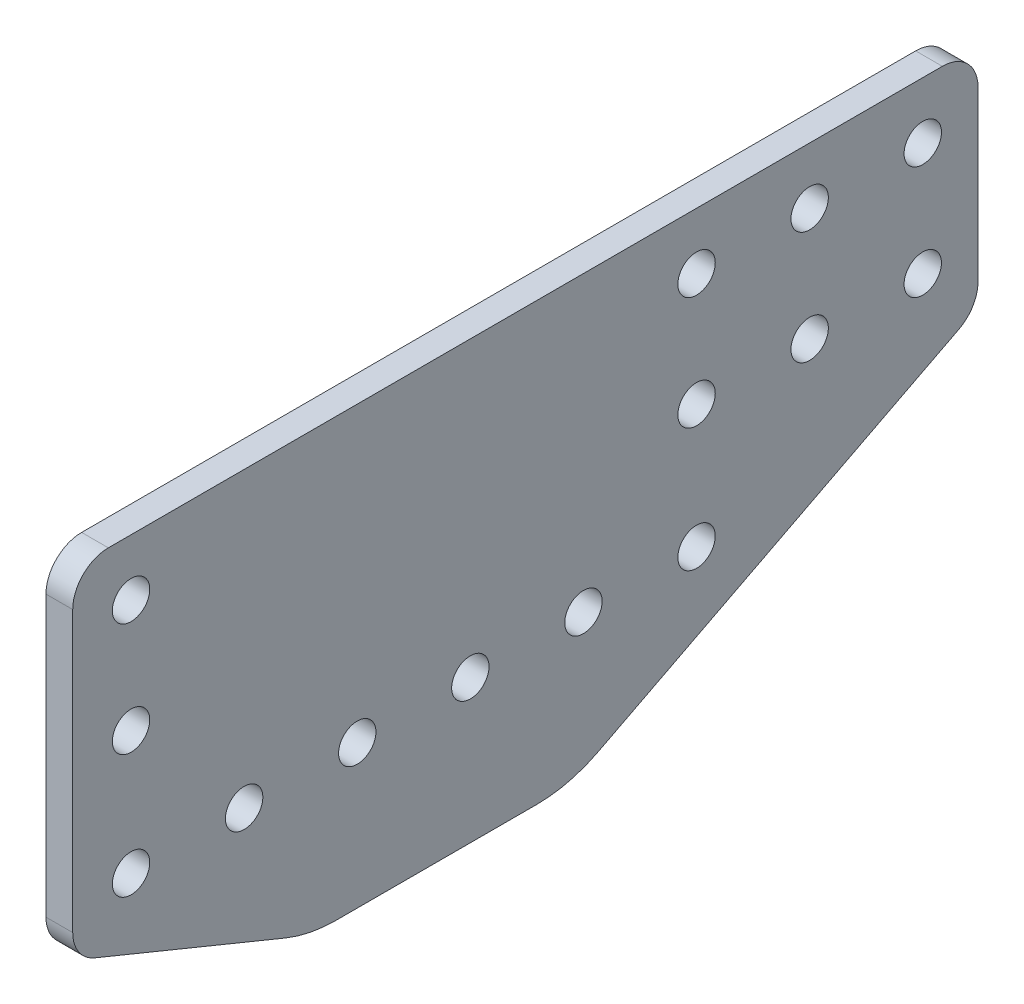
from build123d import *

# Parameters (mm, degrees)
SKETCH_1_R      = 2.1
EXTRUDE_1_DEPTH = 3


with BuildPart() as part:
    # 草图1 → 凸台-拉伸1 (new body)
    with BuildSketch(Plane(origin=(0, 0, 0), x_dir=(0, 0, -1), z_dir=(1, 0, 0))):
        with BuildLine():
            Line((59.529555332, 44.185221984), (59.529555332, 25.226213997))
            ThreePointArc((59.529555332, 25.226213997), (58.943993255, 23.142560073), (57.358748495, 21.668960509))
            Line((57.358748495, 21.668960509), (16.843911029, 0.835622672))
            ThreePointArc((16.843911029, 0.835622672), (13.51321063, -0.403694355), (9.984436669, -0.82467675))
            Line((9.984436669, -0.82467675), (-12.543438126, -0.82467675))
            ThreePointArc((-12.543438126, -0.82467675), (-15.441612868, -0.542033278), (-18.230567587, 0.295245495))
            Line((-18.230567587, 0.295245495), (-39.640671861, 9.067677244))
            ThreePointArc((-39.640671861, 9.067677244), (-41.445720436, 10.540385022), (-42.124104005, 12.769031312))
            Line((-42.124104005, 12.769031312), (-42.124104005, 44.185221984))
            ThreePointArc((-42.124104005, 44.185221984), (-40.95253113, 47.013649109), (-38.124104005, 48.185221984))
            Line((-38.124104005, 48.185221984), (-2.92315645, 48.185221984))
            Line((-2.92315645, 48.185221984), (55.529555332, 48.185221984))
            ThreePointArc((55.529555332, 48.185221984), (58.357982457, 47.013649109), (59.529555332, 44.185221984))
        make_face()
        with Locations((40.626001942, 41.835221984)):
            Circle(SKETCH_1_R, mode=Mode.SUBTRACT)
        with Locations((-35.573998058, 15.266821984)):
            Circle(SKETCH_1_R, mode=Mode.SUBTRACT)
        with Locations((-22.873998058, 15.266821984)):
            Circle(SKETCH_1_R, mode=Mode.SUBTRACT)
        with Locations((-10.173998058, 15.266821984)):
            Circle(SKETCH_1_R, mode=Mode.SUBTRACT)
        with Locations((2.526001942, 15.266821984)):
            Circle(SKETCH_1_R, mode=Mode.SUBTRACT)
        with Locations((15.226001942, 15.266821984)):
            Circle(SKETCH_1_R, mode=Mode.SUBTRACT)
        with Locations((27.926001942, 15.266821984)):
            Circle(SKETCH_1_R, mode=Mode.SUBTRACT)
        with Locations((53.326001942, 41.835221984)):
            Circle(SKETCH_1_R, mode=Mode.SUBTRACT)
        with Locations((53.326001942, 29.135221984)):
            Circle(SKETCH_1_R, mode=Mode.SUBTRACT)
        with Locations((40.626001942, 29.135221984)):
            Circle(SKETCH_1_R, mode=Mode.SUBTRACT)
        with Locations((-35.573998058, 41.835221984)):
            Circle(SKETCH_1_R, mode=Mode.SUBTRACT)
        with Locations((-35.573998058, 29.135221984)):
            Circle(SKETCH_1_R, mode=Mode.SUBTRACT)
        with Locations((27.926001942, 41.835221984)):
            Circle(SKETCH_1_R, mode=Mode.SUBTRACT)
        with Locations((27.926001942, 29.135221984)):
            Circle(SKETCH_1_R, mode=Mode.SUBTRACT)
    extrude(amount=EXTRUDE_1_DEPTH)


solid = part.part
